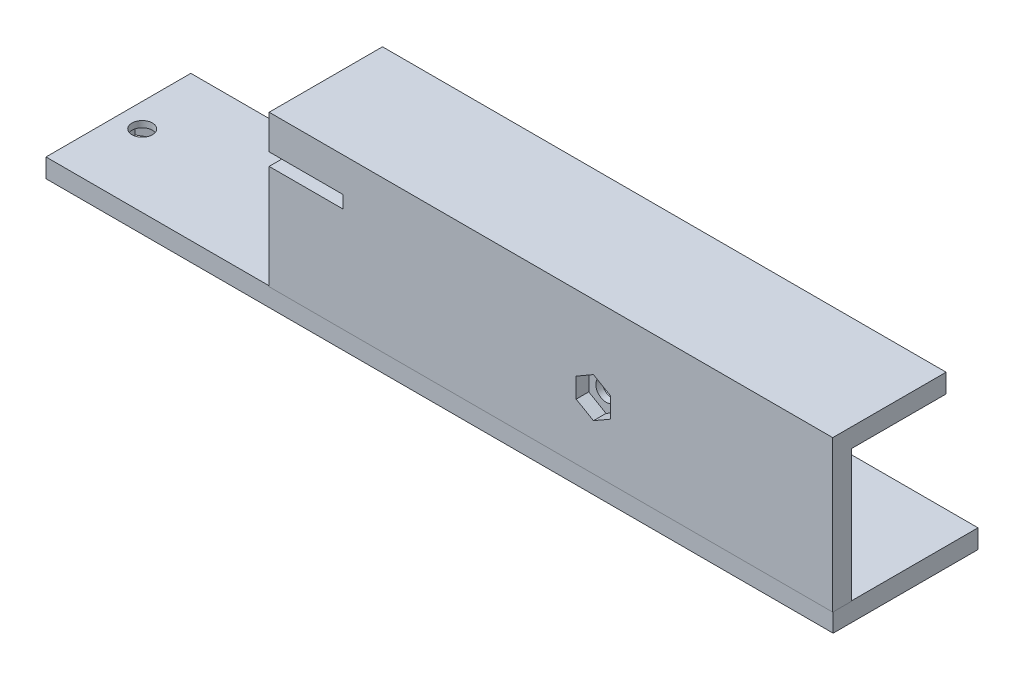
from build123d import *

# Parameters (mm, degrees)
CROQUIS1_R                      = 1.625
SALIENTE_EXTRUIR1_DEPTH         = 3
CORTAR_EXTRUIR1_DEPTH           = 2
CROQUIS3_W                      = 125
CROQUIS3_H                      = 23
CROQUIS3_R                      = 1.625
SALIENTE_EXTRUIR2_DEPTH         = 3
CROQUIS4_W                      = 76
CROQUIS4_H                      = 15
SALIENTE_EXTRUIR3_DEPTH         = 3
SALIENTE_EXTRUIR5_DEPTH         = 13.5
CROQUIS18_W                     = 13
CROQUIS18_H                     = 12
SALIENTE_EXTRUIR6_DEPTH         = 3
CORTAR_EXTRUIR6_DEPTH           = 3
CROQUIS21_W                     = 76.5
CROQUIS21_H                     = 3
SALIENTE_EXTRUIR7_DEPTH         = 3
CROQUIS23_W                     = 11.762217651
CROQUIS23_H                     = 2
CORTAR_EXTRUIR7_DEPTH           = 3
CROQUIS24_R                     = 3.35997123
CORTAR_EXTRUIR8_DEPTH           = 1.8
CORTAR_EXTRUIR8_DRAFT           = -44
CORTAR_EXTRUIR8_PROFILE_2_DEPTH = 1.8
CORTAR_EXTRUIR8_PROFILE_2_DRAFT = -44
CORTAR_EXTRUIR9_DEPTH           = 2


with BuildPart() as part:
    # Croquis1 → Saliente-Extruir1 (new body)
    with BuildSketch(Plane.XY):
        Polygon((7.541029965, -13.191741873), (45.541029965, -13.191741873), (45.541029965, 7.808258127), (-30.458970035, 7.808258127), (-30.458970035, -13.191741873), align=None)
        with Locations((7.541029965, -2.691741873)):
            Circle(CROQUIS1_R, mode=Mode.SUBTRACT)
    extrude(amount=SALIENTE_EXTRUIR1_DEPTH)

    # Croquis2 → Cortar-Extruir1 (cut)
    with BuildSketch(Plane.XY.offset(3)):
        Polygon((7.541029965, 0.478258127), (4.795729435, -1.106741873), (4.795729435, -4.276741873), (7.541029965, -5.861741873), (10.286330495, -4.276741873), (10.286330495, -1.106741873), align=None)
    extrude(amount=-CORTAR_EXTRUIR1_DEPTH, mode=Mode.SUBTRACT)

    # Croquis3 → Saliente-Extruir2 (add)
    with BuildSketch(Plane.XZ.offset(13.191741873)):
        with Locations((-17.025379291, -8.632818511)):
            Rectangle(CROQUIS3_W, CROQUIS3_H)
        with Locations(Location((2.041029965, -14.5, 0), (0, 0, 270))):
            Circle(CROQUIS3_R, mode=Mode.SUBTRACT)
        with Locations(Location((-37.853447155, -14.5, 0), (0, 0, 270))):
            Circle(CROQUIS3_R, mode=Mode.SUBTRACT)
        with Locations(Location((-75.748970035, -8.632818511, 0), (0, 0, 270))):
            Circle(CROQUIS3_R, mode=Mode.SUBTRACT)
        with Locations(Location((-47.888970035, -8.632818511, 0), (0, 0, 270))):
            Circle(CROQUIS3_R, mode=Mode.SUBTRACT)
    extrude(amount=SALIENTE_EXTRUIR2_DEPTH)

    # Croquis4 → Saliente-Extruir3 (add)
    with BuildSketch(Plane(origin=(0, 7.808258127, 0), x_dir=(1, 0, 0), z_dir=(0, 1, 0))):
        with Locations((7.541029965, 4.5)):
            Rectangle(CROQUIS4_W, CROQUIS4_H)
    extrude(amount=SALIENTE_EXTRUIR3_DEPTH)

    # Croquis14 → Saliente-Extruir5 (add)
    with BuildSketch(Plane.ZY.offset(30.458970035)):
        Polygon((-12, 10.808258127), (3, 10.808258127), (3, -13.191741873), (0, -13.191741873), (0, 7.808258127), (-12, 7.808258127), align=None)
    extrude(amount=SALIENTE_EXTRUIR5_DEPTH)

    # Croquis18 → Saliente-Extruir6 (add)
    with BuildSketch(Plane(origin=(0, 0, -12), x_dir=(-1, 0, 0), z_dir=(0, 0, -1))):
        with Locations((37.458970035, 4.808258127)):
            Rectangle(CROQUIS18_W, CROQUIS18_H)
    extrude(amount=SALIENTE_EXTRUIR6_DEPTH)

    # Croquis19 → Cortar-Extruir6 (cut)
    with BuildSketch(Plane(origin=(0, 0, -15), x_dir=(-1, 0, 0), z_dir=(0, 0, -1))):
        with BuildLine():
            Line((37.340127553, 7.35825754), (43.958970035, 7.35825754))
            Line((43.958970035, 7.35825754), (43.958970035, 1.358257834))
            Line((43.958970035, 1.358257834), (37.340127553, 1.358257834))
            ThreePointArc((37.340127553, 1.358257834), (34.310076321, 4.358257687), (37.340127553, 7.35825754))
        make_face()
    extrude(amount=-CORTAR_EXTRUIR6_DEPTH, mode=Mode.SUBTRACT)

    # Croquis21 → Saliente-Extruir7 (add)
    with BuildSketch(Plane(origin=(0, 10.808258127, 0), x_dir=(1, 0, 0), z_dir=(0, 1, 0))):
        with Locations((7.291029965, 13.5)):
            Rectangle(CROQUIS21_W, CROQUIS21_H)
    extrude(amount=-SALIENTE_EXTRUIR7_DEPTH)

    # Croquis23 → Cortar-Extruir7 (cut)
    with BuildSketch(Plane.XY.offset(3)):
        with Locations((-38.077861209, 4.358257834)):
            Rectangle(CROQUIS23_W, CROQUIS23_H)
    extrude(amount=-CORTAR_EXTRUIR7_DEPTH, mode=Mode.SUBTRACT)


with BuildPart() as cortar_extruir8_tool:
    # Croquis24 → Cortar-Extruir8 (with draft: the straight prism first)
    with BuildSketch(Plane(origin=(0, -13.191741873, 0), x_dir=(1, 0, 0), z_dir=(0, 1, 0))):
        with Locations((2.041029965, 14.5)):
            Circle(CROQUIS24_R)
    extrude(amount=-CORTAR_EXTRUIR8_DEPTH)
    # Cortar-Extruir8: the draft: its side faces are tilted about the plane it starts from
    cortar_extruir8_sides = [cortar_extruir8_tool.faces().sort_by_distance(p)[0] for p in [
        (-1.318941265, -14.091741873, -14.5),
    ]]
    draft(cortar_extruir8_sides, Plane(origin=(0, -13.191741873, 0), x_dir=(1, 0, 0), z_dir=(0, 1, 0)), CORTAR_EXTRUIR8_DRAFT)


with BuildPart() as part_1:
    add(part.part)

    # Cortar-Extruir8: cut by cortar_extruir8_tool
    add(cortar_extruir8_tool.part, mode=Mode.SUBTRACT)


with BuildPart() as cortar_extruir8_profile_2_tool:
    # Croquis24 → Cortar-Extruir8 profile 2 (with draft: the straight prism first)
    with BuildSketch(Plane(origin=(0, -13.191741873, 0), x_dir=(1, 0, 0), z_dir=(0, 1, 0))):
        with Locations((-37.853447155, 14.5)):
            Circle(CROQUIS24_R)
    extrude(amount=-CORTAR_EXTRUIR8_PROFILE_2_DEPTH)
    # Cortar-Extruir8 profile 2: the draft: its side faces are tilted about the plane it starts from
    cortar_extruir8_profile_2_sides = [cortar_extruir8_profile_2_tool.faces().sort_by_distance(p)[0] for p in [
        (-41.213418385, -14.091741873, -14.5),
    ]]
    draft(cortar_extruir8_profile_2_sides, Plane(origin=(0, -13.191741873, 0), x_dir=(1, 0, 0), z_dir=(0, 1, 0)), CORTAR_EXTRUIR8_PROFILE_2_DRAFT)


with BuildPart() as part_2:
    add(part_1.part)

    # Cortar-Extruir8 profile 2: cut by cortar_extruir8_profile_2_tool
    add(cortar_extruir8_profile_2_tool.part, mode=Mode.SUBTRACT)

    # Croquis25 → Cortar-Extruir9 (cut)
    with BuildSketch(Plane.XZ.offset(16.191741873)):
        Polygon((-47.922954999, -5.403954828), (-50.668255529, -6.988954828), (-50.668255529, -10.158954828), (-47.922954999, -11.743954828), (-45.177654469, -10.158954828), (-45.177654469, -6.988954828), align=None)
        Polygon((-75.748970035, -5.462818511), (-78.494270565, -7.047818511), (-78.494270565, -10.217818511), (-75.748970035, -11.802818511), (-73.003669505, -10.217818511), (-73.003669505, -7.047818511), align=None)
    extrude(amount=-CORTAR_EXTRUIR9_DEPTH, mode=Mode.SUBTRACT)


solid = part_2.part
